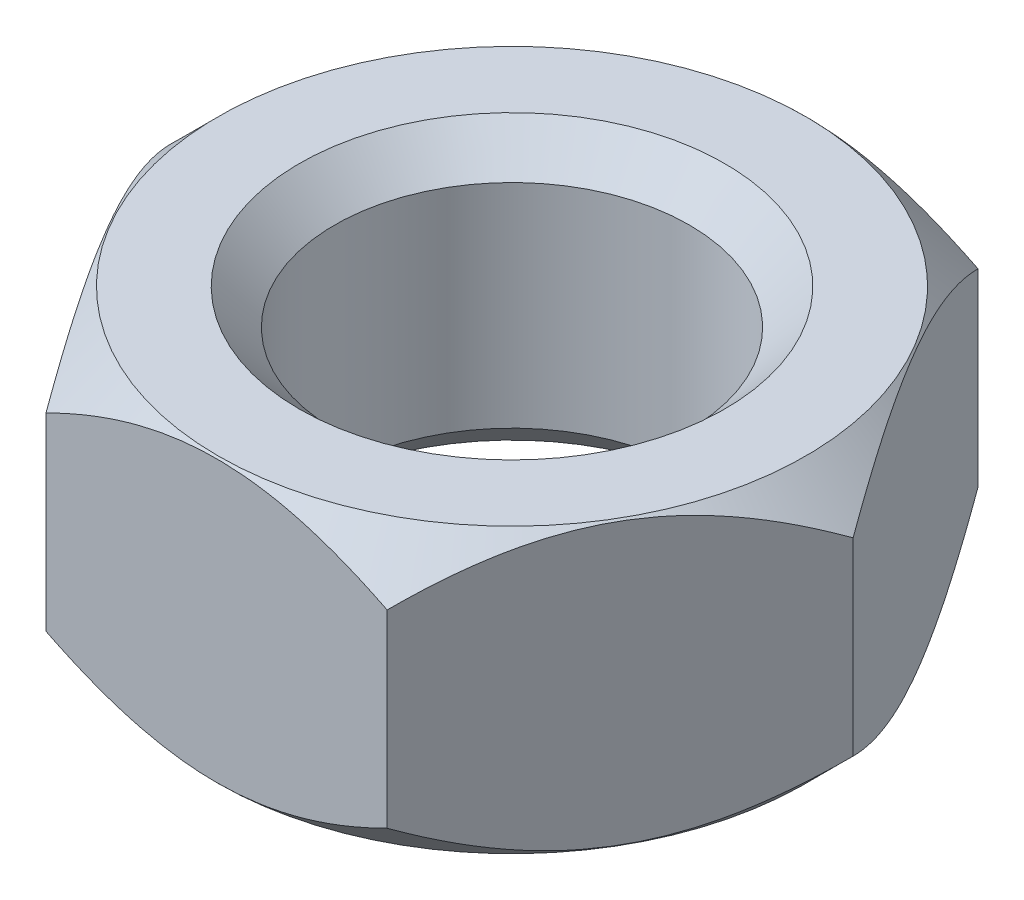
from build123d import *

# Parameters (mm, degrees)
EXTRUDE_1_DEPTH     = 2.4
SKETCH_2_R          = 1.5
CUT_EXTRUDE_1_DEPTH = 5.510358448
CHAMFER_1_SIZE      = 0.3


with BuildPart() as part:
    # Эскиз1 → Вытянуть1 (new body)
    with BuildSketch(Plane(origin=(0, 0, 0), x_dir=(1, 0, 0), z_dir=(0, 1, 0))):
        Polygon((-1.443375673, 2.5), (1.443375673, 2.5), (2.886751346, 0), (1.443375673, -2.5), (-1.443375673, -2.5), (-2.886751346, 0), align=None)
    extrude(amount=-EXTRUDE_1_DEPTH)

    # Эскиз2 → Вырез-Вытянуть1 (cut, through all)
    with BuildSketch(Plane(origin=(0, 0, 0), x_dir=(-1, 0, 0), z_dir=(0, 1, 0))):
        with Locations(Location((0, 0, 0), (0, 0, 90))):
            Circle(SKETCH_2_R)
    extrude(amount=-CUT_EXTRUDE_1_DEPTH, mode=Mode.SUBTRACT)

    # Фаска1
    chamfer_1_edges = [part.edges().sort_by_distance(p)[0] for p in [
        (0, -2.4, -1.5),
        (0, 0, -1.5),
    ]]
    chamfer(chamfer_1_edges, length=CHAMFER_1_SIZE)

    # Эскиз3 → Вырез-Повернуть1 (revolve, cut)
    with BuildSketch(Plane.XY, mode=Mode.PRIVATE) as cut_revolve_1_sk:
        Polygon((-2.886751346, 0), (-2.486751346, 0), (-2.886751346, -0.4), align=None)
        Polygon((-2.886751346, -2), (-2.886751346, -2.4), (-2.486751346, -2.4), align=None)
    revolve(cut_revolve_1_sk.sketch.rotate(Axis((0, -0.3, 0), (0, -1, 0)), 120.000000241), axis=Axis((0, -0.3, 0), (0, -1, 0)), mode=Mode.SUBTRACT)


solid = part.part
